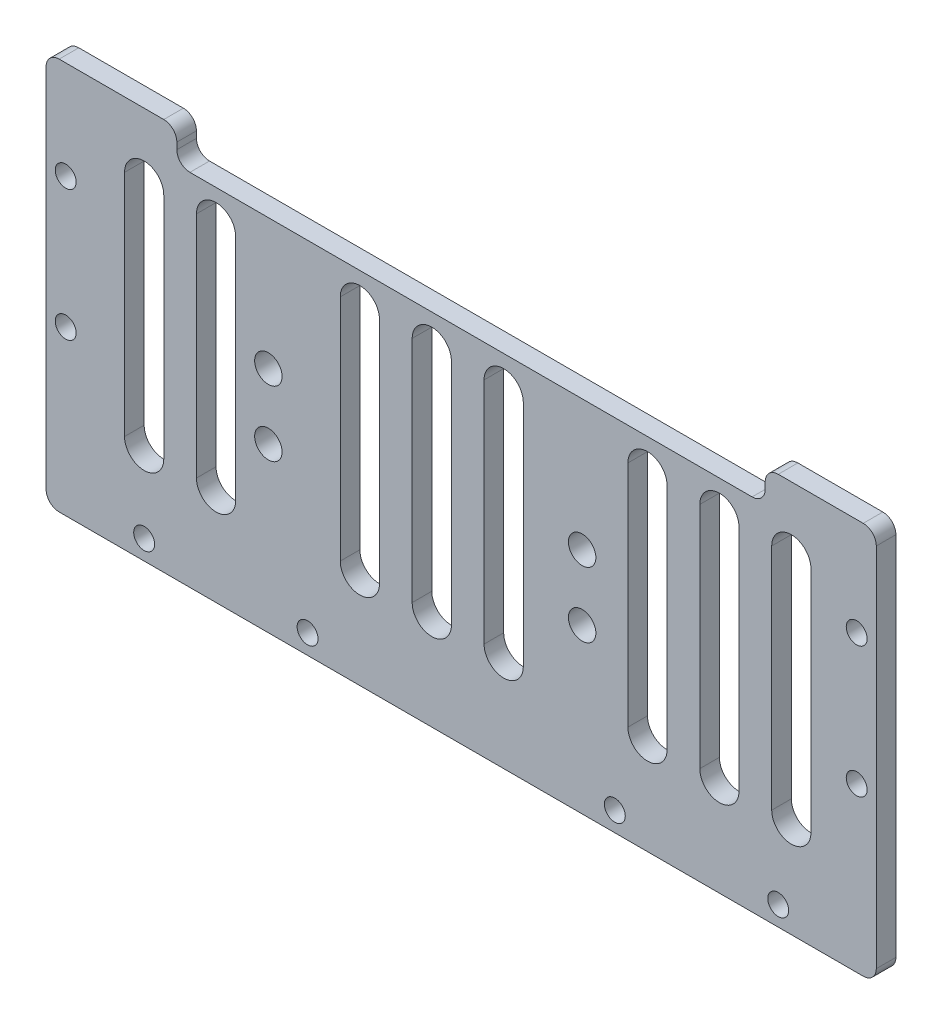
from build123d import *

# Parameters (mm, degrees)
EXTRUDE_1_DEPTH     = 3
CUT_EXTRUDE_1_REACH = 142.492
SKETCH_2_R          = 1.6
SKETCH_3_R          = 1.6
CUT_EXTRUDE_2_DEPTH = 3
SKETCH_4_R          = 2.1
CUT_EXTRUDE_3_DEPTH = 10
CUT_EXTRUDE_4_DEPTH = 10
SKETCH_6_W          = 90
SKETCH_6_H          = 5
CUT_EXTRUDE_5_DEPTH = 10
FILLET_1_R          = 2


with BuildPart() as part:
    # 草图1 → 凸台-拉伸1 (new body)
    with BuildSketch(Plane.XY):
        with BuildLine():
            Line((2, 0), (125, 0))
            ThreePointArc((125, 0), (126.414213562, 0.585786438), (127, 2))
            Line((127, 2), (127, 58))
            ThreePointArc((127, 58), (126.414213562, 59.414213562), (125, 60))
            Line((125, 60), (2, 60))
            ThreePointArc((2, 60), (0.585786438, 59.414213562), (0, 58))
            Line((0, 58), (0, 2))
            ThreePointArc((0, 2), (0.585786438, 0.585786438), (2, 0))
        make_face()
    extrude(amount=EXTRUDE_1_DEPTH)

    # 草图2 → 切除-拉伸1 (cut, up to next)
    with BuildSketch(Plane.XY.offset(3), mode=Mode.PRIVATE) as cut_extrude_1_sk1:
        with Locations((15, 3)):
            Circle(SKETCH_2_R)
    cut_extrude_1_tool1 = extrude(cut_extrude_1_sk1.sketch, amount=-CUT_EXTRUDE_1_REACH, mode=Mode.PRIVATE) & part.part
    # 草图2 → 切除-拉伸1 (cut, up to next)
    with BuildSketch(Plane.XY.offset(3), mode=Mode.PRIVATE) as cut_extrude_1_sk2:
        with Locations((40, 3)):
            Circle(SKETCH_2_R)
    cut_extrude_1_tool2 = extrude(cut_extrude_1_sk2.sketch, amount=-CUT_EXTRUDE_1_REACH, mode=Mode.PRIVATE) & part.part
    # 草图2 → 切除-拉伸1 (cut, up to next)
    with BuildSketch(Plane.XY.offset(3), mode=Mode.PRIVATE) as cut_extrude_1_sk3:
        with Locations((87, 3)):
            Circle(SKETCH_2_R)
    cut_extrude_1_tool3 = extrude(cut_extrude_1_sk3.sketch, amount=-CUT_EXTRUDE_1_REACH, mode=Mode.PRIVATE) & part.part
    # 草图2 → 切除-拉伸1 (cut, up to next)
    with BuildSketch(Plane.XY.offset(3), mode=Mode.PRIVATE) as cut_extrude_1_sk4:
        with Locations((112, 3)):
            Circle(SKETCH_2_R)
    cut_extrude_1_tool4 = extrude(cut_extrude_1_sk4.sketch, amount=-CUT_EXTRUDE_1_REACH, mode=Mode.PRIVATE) & part.part
    add(cut_extrude_1_tool1.solids().sort_by_distance((15, 3, 3))[0], mode=Mode.SUBTRACT)
    add(cut_extrude_1_tool2.solids().sort_by_distance((40, 3, 3))[0], mode=Mode.SUBTRACT)
    add(cut_extrude_1_tool3.solids().sort_by_distance((87, 3, 3))[0], mode=Mode.SUBTRACT)
    add(cut_extrude_1_tool4.solids().sort_by_distance((112, 3, 3))[0], mode=Mode.SUBTRACT)

    # 草图3 → 切除-拉伸2 (cut)
    with BuildSketch(Plane.XY.offset(3)):
        with Locations((3, 45)):
            Circle(SKETCH_3_R)
        with Locations((3, 25)):
            Circle(SKETCH_3_R)
        with Locations(Location((124, 25, 0), (0, 0, 180))):
            Circle(SKETCH_3_R)
        with Locations(Location((124, 45, 0), (0, 0, 180))):
            Circle(SKETCH_3_R)
    extrude(amount=-CUT_EXTRUDE_2_DEPTH, mode=Mode.SUBTRACT)

    # 草图4 → 切除-拉伸3 (cut)
    with BuildSketch(Plane.XY.offset(3)):
        with Locations((82, 35)):
            Circle(SKETCH_4_R)
        with Locations((34, 35)):
            Circle(SKETCH_4_R)
        with Locations((34, 25)):
            Circle(SKETCH_4_R)
        with Locations((82, 25)):
            Circle(SKETCH_4_R)
    extrude(amount=-CUT_EXTRUDE_3_DEPTH, mode=Mode.SUBTRACT)

    # 草图5 → 切除-拉伸4 (cut)
    with BuildSketch(Plane(origin=(0, 0, 0), x_dir=(-1, 0, 0), z_dir=(0, 0, -1))):
        with BuildLine():
            Line((-111, 50), (-111, 15))
            ThreePointArc((-111, 15), (-114, 12), (-117, 15))
            Line((-117, 15), (-117, 50))
            ThreePointArc((-117, 50), (-114, 53), (-111, 50))
        make_face()
        with BuildLine():
            Line((-100, 50), (-100, 15))
            ThreePointArc((-100, 15), (-103, 12), (-106, 15))
            Line((-106, 15), (-106, 50))
            ThreePointArc((-106, 50), (-103, 53), (-100, 50))
        make_face()
        with BuildLine():
            Line((-89, 50), (-89, 15))
            ThreePointArc((-89, 15), (-92, 12), (-95, 15))
            Line((-95, 15), (-95, 50))
            ThreePointArc((-95, 50), (-92, 53), (-89, 50))
        make_face()
        with BuildLine():
            Line((-67, 50), (-67, 15))
            ThreePointArc((-67, 15), (-70, 12), (-73, 15))
            Line((-73, 15), (-73, 50))
            ThreePointArc((-73, 50), (-70, 53), (-67, 50))
        make_face()
        with BuildLine():
            Line((-56, 50), (-56, 15))
            ThreePointArc((-56, 15), (-59, 12), (-62, 15))
            Line((-62, 15), (-62, 50))
            ThreePointArc((-62, 50), (-59, 53), (-56, 50))
        make_face()
        with BuildLine():
            Line((-45, 50), (-45, 15))
            ThreePointArc((-45, 15), (-48, 12), (-51, 15))
            Line((-51, 15), (-51, 50))
            ThreePointArc((-51, 50), (-48, 53), (-45, 50))
        make_face()
        with BuildLine():
            Line((-23, 50), (-23, 15))
            ThreePointArc((-23, 15), (-26, 12), (-29, 15))
            Line((-29, 15), (-29, 50))
            ThreePointArc((-29, 50), (-26, 53), (-23, 50))
        make_face()
        with BuildLine():
            Line((-12, 50), (-12, 15))
            ThreePointArc((-12, 15), (-15, 12), (-18, 15))
            Line((-18, 15), (-18, 50))
            ThreePointArc((-18, 50), (-15, 53), (-12, 50))
        make_face()
    extrude(amount=-CUT_EXTRUDE_4_DEPTH, mode=Mode.SUBTRACT)

    # 草图6 → 切除-拉伸5 (cut)
    with BuildSketch(Plane(origin=(0, 0, 0), x_dir=(-1, 0, 0), z_dir=(0, 0, -1))):
        with Locations((-65, 57.5)):
            Rectangle(SKETCH_6_W, SKETCH_6_H)
    extrude(amount=-CUT_EXTRUDE_5_DEPTH, mode=Mode.SUBTRACT)

    # 圆角1
    fillet_1_edges = [part.edges().sort_by_distance(p)[0] for p in [
        (110, 55, 1.5),
        (110, 60, 1.5),
        (20, 60, 1.5),
        (20, 55, 1.5),
    ]]
    fillet(fillet_1_edges, radius=FILLET_1_R)


solid = part.part
